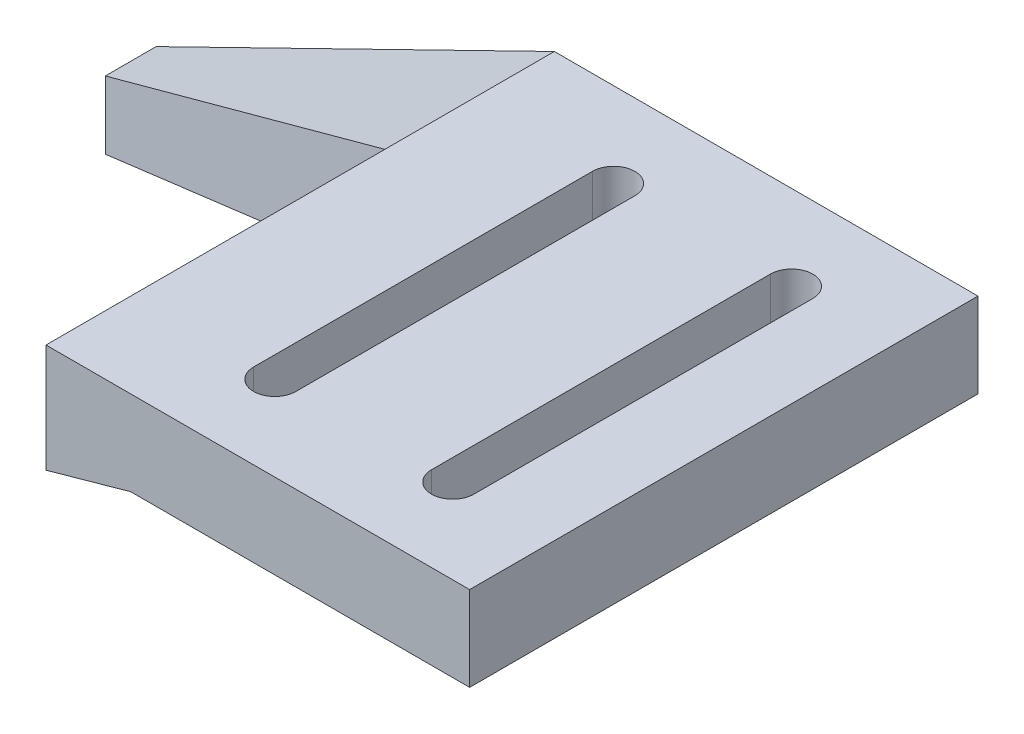
from build123d import *

# Parameters (mm, degrees)
SALIENTE_EXTRUIR1_DEPTH = 5
CORTAR_EXTRUIR1_DEPTH   = 15
SALIENTE_EXTRUIR2_DEPTH = 20
CORTAR_EXTRUIR2_DEPTH   = 30


with BuildPart() as part:
    # Croquis1 → Saliente-Extruir1 (new, symmetric)
    with BuildSketch(Plane.XY):
        Polygon((-2.5, 4), (2.5, -1), (-22.5, -8), (-22.5, -4), align=None)
        Polygon((22.5, 4), (-2.5, 4), (2.5, -1), (22.5, -1), align=None)
    extrude(amount=SALIENTE_EXTRUIR1_DEPTH, both=True)

    # Croquis3 → Cortar-Extruir1 (cut, symmetric)
    with BuildSketch(Plane(origin=(0, 0, 0), x_dir=(1, 0, 0), z_dir=(0, 1, 0))):
        Polygon((-22.5, 1.5), (-2.5, 5), (-22.5, 5), align=None)
        Polygon((-2.5, -5), (-22.5, -5), (-22.5, -1.5), align=None)
    extrude(amount=CORTAR_EXTRUIR1_DEPTH, both=True, mode=Mode.SUBTRACT)

    # Croquis5 → Saliente-Extruir2 (add)
    with BuildSketch(Plane.XY.offset(5)):
        Polygon((-2.5, 4), (-2.5, -2.4), (2.5, -1), (22.5, -1), (22.5, 4), align=None)
    extrude(amount=SALIENTE_EXTRUIR2_DEPTH)

    # Croquis2 → Cortar-Extruir2 (cut)
    with BuildSketch(Plane(origin=(0, 4, 0), x_dir=(1, 0, 0), z_dir=(0, 1, 0))):
        with BuildLine():
            Line((7.25, 0), (7.25, -20))
            ThreePointArc((7.25, -20), (6, -21.25), (4.75, -20))
            Line((4.75, -20), (4.75, 0))
            ThreePointArc((4.75, 0), (6, 1.25), (7.25, 0))
        make_face()
        with BuildLine():
            Line((15.25, 0), (15.25, -20))
            ThreePointArc((15.25, -20), (16.5, -21.25), (17.75, -20))
            Line((17.75, -20), (17.75, 0))
            ThreePointArc((17.75, 0), (16.5, 1.25), (15.25, 0))
        make_face()
    extrude(amount=-CORTAR_EXTRUIR2_DEPTH, mode=Mode.SUBTRACT)


solid = part.part
